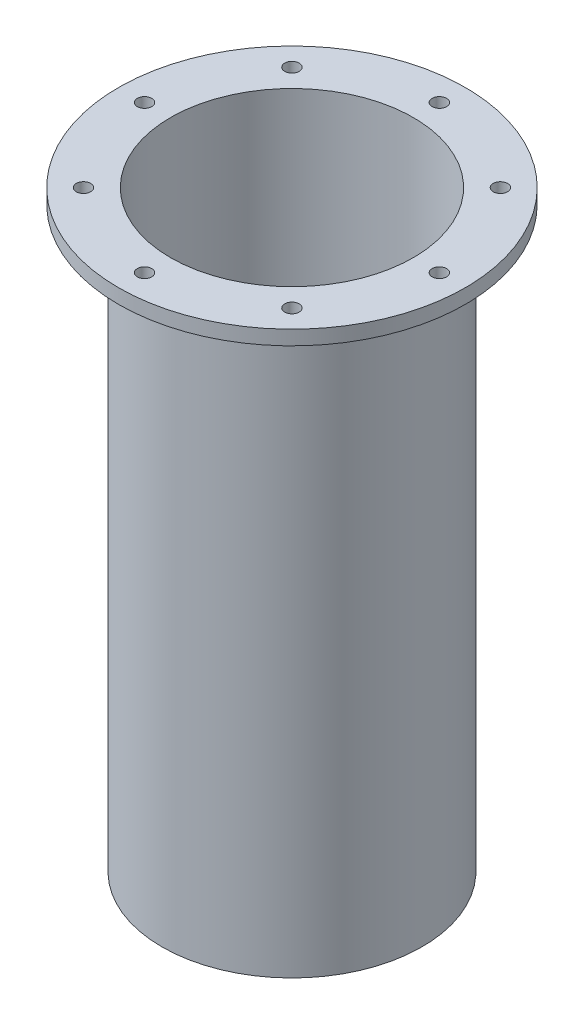
from build123d import *

# Parameters (mm, degrees)
SKETCH1_R                = 57.15
SKETCH1_R_2              = 53.34
SCHEDULED_CHAMBER_DEPTH  = 260.35
SKETCH2_R                = 76.2
SKETCH2_R_2              = 57.15
FLANGE_DEPTH             = 6.35
ORIGINAL_BOLT_HOLE_REACH = 283.771
SKETCH3_R                = 3.175
BOLT_HOLE_PATTERN_COUNT  = 8


with BuildPart() as part:
    # Sketch1 → Scheduled Chamber (new body)
    with BuildSketch(Plane(origin=(0, 0, 0), x_dir=(1, 0, 0), z_dir=(0, 1, 0))):
        Circle(SKETCH1_R)
        Circle(SKETCH1_R_2, mode=Mode.SUBTRACT)
    extrude(amount=-SCHEDULED_CHAMBER_DEPTH)

    # Sketch2 → Flange (add)
    with BuildSketch(Plane(origin=(0, 0, 0), x_dir=(1, 0, 0), z_dir=(0, 1, 0))):
        Circle(SKETCH2_R)
        Circle(SKETCH2_R_2, mode=Mode.SUBTRACT)
    extrude(amount=-FLANGE_DEPTH)

    # Sketch3 → Original Bolt Hole (cut, up to next)
    with BuildSketch(Plane(origin=(0, 0, 0), x_dir=(1, 0, 0), z_dir=(0, 1, 0)), mode=Mode.PRIVATE) as original_bolt_hole_sk1:
        with Locations((0, 64.77)):
            Circle(SKETCH3_R)
    original_bolt_hole_tool1 = extrude(original_bolt_hole_sk1.sketch, amount=-ORIGINAL_BOLT_HOLE_REACH, mode=Mode.PRIVATE) & part.part
    original_bolt_hole = original_bolt_hole_tool1.solids().sort_by_distance((0, 0, -64.77))[0]
    add(original_bolt_hole, mode=Mode.SUBTRACT)

    # Bolt Hole Pattern: Original Bolt Hole ×8 about axis
    bolt_hole_pattern_axis = Axis((0, 55, 0), (0, -1, 0))
    for i in range(1, BOLT_HOLE_PATTERN_COUNT):
        add(original_bolt_hole.rotate(bolt_hole_pattern_axis, i * 360 / BOLT_HOLE_PATTERN_COUNT), mode=Mode.SUBTRACT)


solid = part.part
